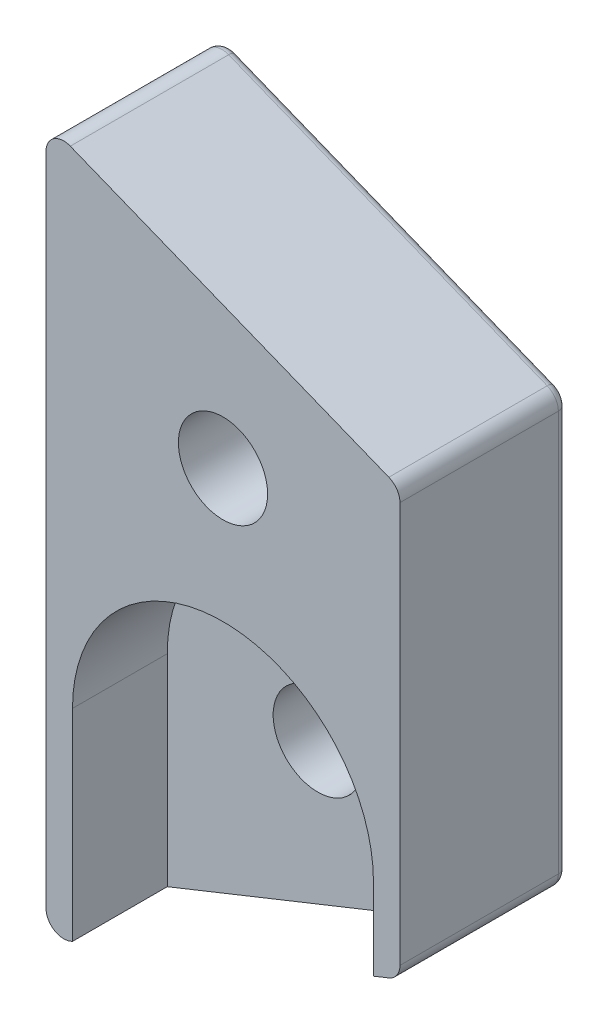
from build123d import *

# Parameters (mm, degrees)
SKETCH1_R           = 2
BOSS_EXTRUDE1_DEPTH = 7.5
FILLET1_R           = 0.79375
CUT_EXTRUDE1_DEPTH  = 4.25
FILLET2_R           = 0.396875


with BuildPart() as part:
    # Sketch1 → Boss-Extrude1 (new body)
    with BuildSketch(Plane.XY):
        Polygon((0, 0), (15.875, -6.35), (15.875, -25.4), (0, -31.75), align=None)
        with Locations((7.9375, -22.225)):
            Circle(SKETCH1_R, mode=Mode.SUBTRACT)
        with Locations((7.9375, -9.525)):
            Circle(SKETCH1_R, mode=Mode.SUBTRACT)
    extrude(amount=BOSS_EXTRUDE1_DEPTH)

    # Fillet1
    fillet1_edges = [part.edges().sort_by_distance(p)[0] for p in [
        (0, 0, 3.75),
        (15.875, -6.35, 3.75),
        (15.875, -25.4, 3.75),
        (0, -31.75, 3.75),
    ]]
    fillet(fillet1_edges, radius=FILLET1_R)

    # Sketch2 → Cut-Extrude1 (cut)
    with BuildSketch(Plane.XY.offset(7.5)):
        with BuildLine():
            Line((14.6875, -22.225), (14.6875, -25.875))
            Line((14.6875, -25.875), (1.1875, -31.275))
            Line((1.1875, -31.275), (1.1875, -22.225))
            ThreePointArc((1.1875, -22.225), (7.9375, -15.475), (14.6875, -22.225))
        make_face()
    extrude(amount=-CUT_EXTRUDE1_DEPTH, mode=Mode.SUBTRACT)

    # Fillet2
    fillet2_edges = [part.edges().sort_by_distance(p)[0] for p in [
        (8.232291349, -28.45708346, 0),
        (0, -15.875, 0),
        (8.232291349, -3.29291654, 0),
        (15.875, -15.875, 0),
        (0.348750883, -0.515116549, 0),
        (15.738528364, -6.442395796, 0),
        (15.738528364, -25.307604204, 0),
        (0.348750883, -31.234883451, 0),
    ]]
    fillet(fillet2_edges, radius=FILLET2_R)


solid = part.part
